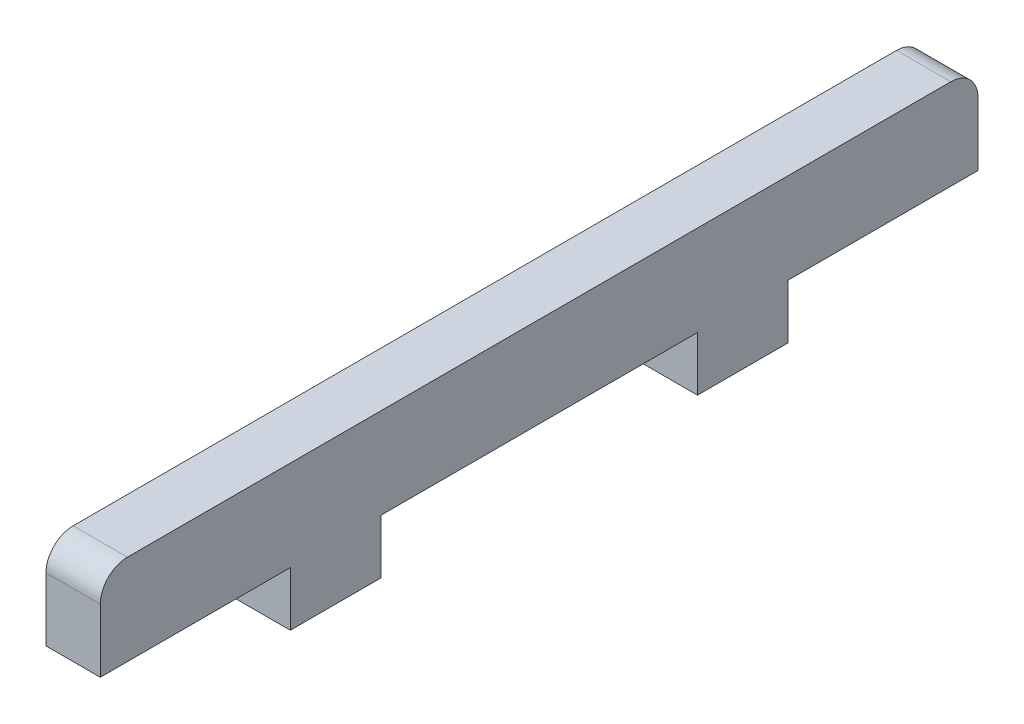
from build123d import *

# Parameters (mm, degrees)
BOSS_EXTRUDE1_DEPTH = 6
FILLET1_R           = 3


with BuildPart() as part:
    # Sketch1 → Boss-Extrude1 (new body)
    with BuildSketch(Plane(origin=(0, 0, 0), x_dir=(0, 0, -1), z_dir=(1, 0, 0))):
        Polygon((-390.651166818, 243.904678423), (-293.651166818, 243.904678423), (-293.651166818, 233.904678423), (-314.651166818, 233.904678423), (-314.651166818, 227.904678423), (-324.651166818, 227.904678423), (-324.651166818, 233.904678423), (-359.651166818, 233.904678423), (-359.651166818, 227.904678423), (-369.651166818, 227.904678423), (-369.651166818, 233.904678423), (-390.651166818, 233.904678423), align=None)
    extrude(amount=BOSS_EXTRUDE1_DEPTH)

    # Fillet1
    fillet1_edges = [part.edges().sort_by_distance(p)[0] for p in [
        (3, 243.904678423, 390.651166818),
        (3, 243.904678423, 293.651166818),
    ]]
    fillet(fillet1_edges, radius=FILLET1_R)


solid = part.part
